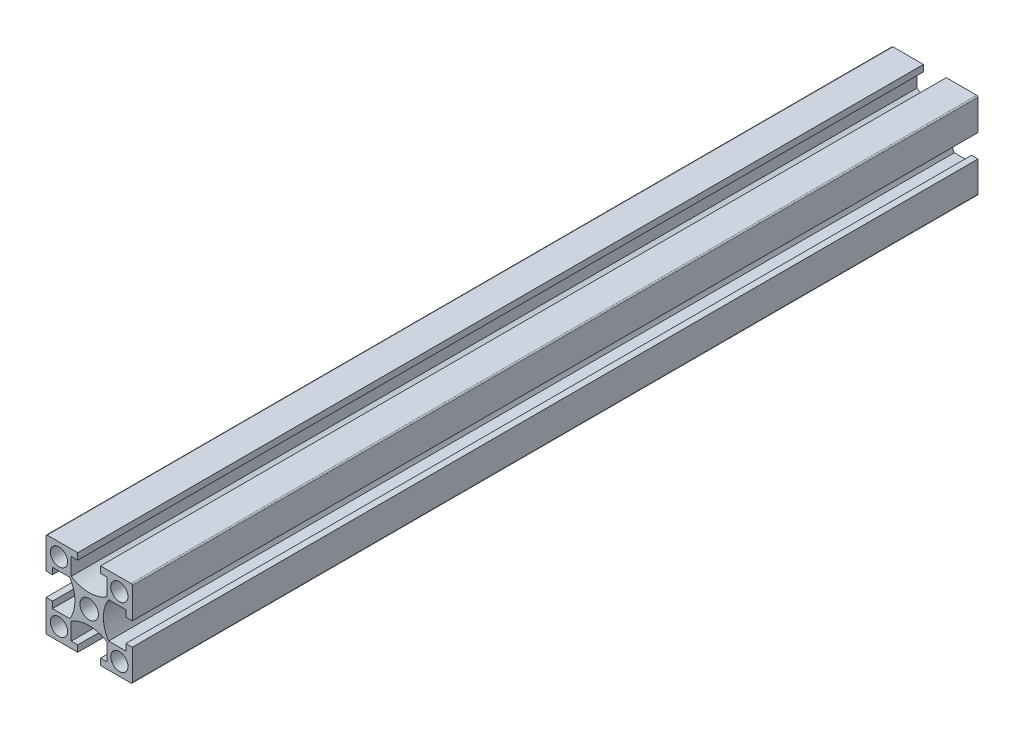
from build123d import *

# Parameters (mm, degrees)
SKETCH_1_W               = 20
SKETCH_1_H               = 20
SKETCH_1_R               = 2
SKETCH_1_R_2             = 2.15
EXTRUDE_1_DEPTH          = 196
CUT_EXTRUDE_1_REACH      = 198.51
PATTERN_CIRCULAR_1_COUNT = 4
FILLET_1_R               = 0.3
SKETCH_4_R               = 2.5
CUT_EXTRUDE_4_DEPTH      = 198.271386673


with BuildPart() as part:
    # 스케치1 → 보스-돌출1 (new body)
    with BuildSketch(Plane.XY):
        Rectangle(SKETCH_1_W, SKETCH_1_H)
        with Locations((-7, -7)):
            Circle(SKETCH_1_R, mode=Mode.SUBTRACT)
        with Locations((7, -7)):
            Circle(SKETCH_1_R, mode=Mode.SUBTRACT)
        with Locations((-7, 7)):
            Circle(SKETCH_1_R, mode=Mode.SUBTRACT)
        Circle(SKETCH_1_R_2, mode=Mode.SUBTRACT)
        with Locations((7, 7)):
            Circle(SKETCH_1_R, mode=Mode.SUBTRACT)
    extrude(amount=EXTRUDE_1_DEPTH)

    # 스케치1<3> → 컷-돌출1 (cut, up to next)
    with BuildSketch(Plane.XY, mode=Mode.PRIVATE) as cut_extrude_1_sk1:
        with BuildLine():
            Line((-8.5, 2.65), (-10, 2.65))
            Line((-10, 2.65), (-10, -2.65))
            Line((-10, -2.65), (-8.5, -2.65))
            Line((-8.5, -2.65), (-8.5, -4.15))
            Line((-8.5, -4.15), (-4.503166667, -4.15))
            ThreePointArc((-4.503166667, -4.15), (-3.3, 0), (-4.503166667, 4.15))
            Line((-4.503166667, 4.15), (-8.5, 4.15))
            Line((-8.5, 4.15), (-8.5, 2.65))
        make_face()
    cut_extrude_1_tool1 = extrude(cut_extrude_1_sk1.sketch, amount=CUT_EXTRUDE_1_REACH, mode=Mode.PRIVATE) & part.part
    cut_extrude_1 = cut_extrude_1_tool1.solids().sort_by_distance((-6.606913, 0, 0))[0]
    add(cut_extrude_1, mode=Mode.SUBTRACT)

    # 원형 패턴1: 컷-돌출1 ×4 about axis
    pattern_circular_1_axis = Axis((0, 0, 196), (0, 0, -1))
    for i in range(1, PATTERN_CIRCULAR_1_COUNT):
        add(cut_extrude_1.rotate(pattern_circular_1_axis, i * 360 / PATTERN_CIRCULAR_1_COUNT), mode=Mode.SUBTRACT)

    # 필렛1
    fillet_1_edges = [part.edges().sort_by_distance(p)[0] for p in [
        (10, -10, 98),
        (-10, -10, 98),
        (-10, 10, 98),
        (10, 10, 98),
    ]]
    fillet(fillet_1_edges, radius=FILLET_1_R)

    # 스케치4 → 컷-돌출4 (cut, through all)
    with BuildSketch(Plane.XZ.offset(10)):
        with Locations((0, 98)):
            Circle(SKETCH_4_R)
    extrude(amount=-CUT_EXTRUDE_4_DEPTH, mode=Mode.SUBTRACT)


solid = part.part
